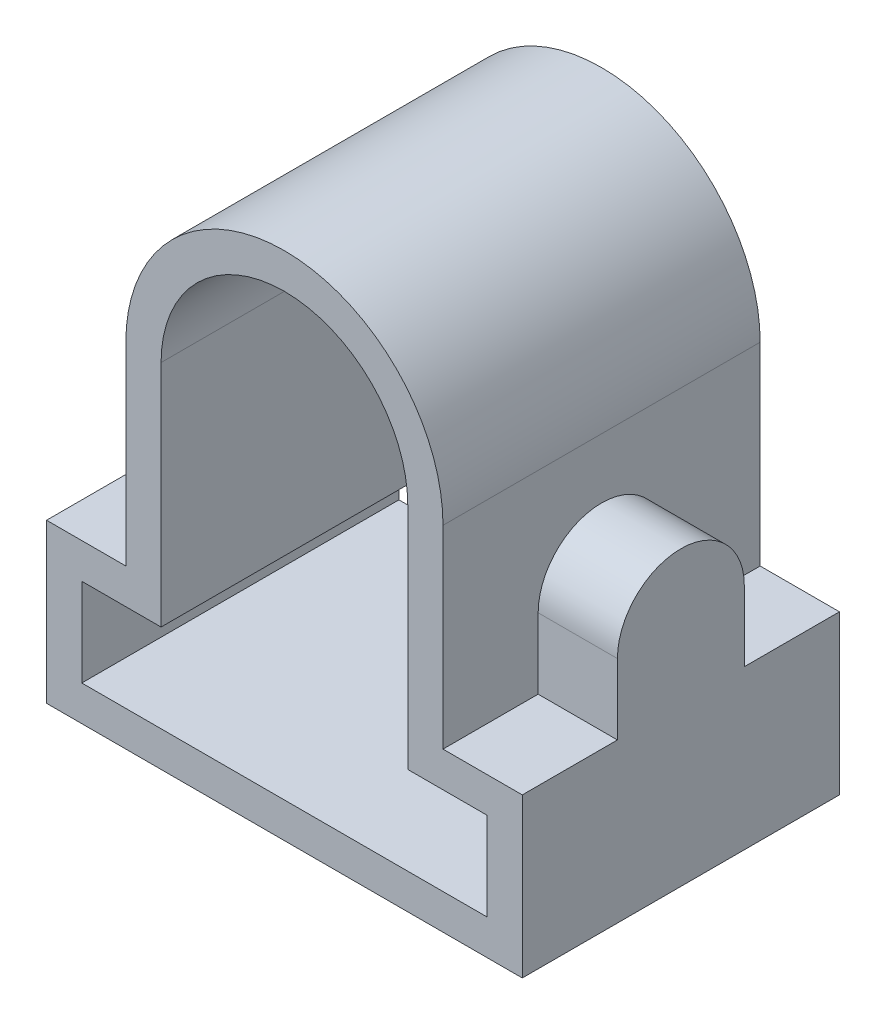
from build123d import *

# Parameters (mm, degrees)
DODANIE_WYCI_GNI_CIE1_DEPTH = 45
DODANIE_WYCI_GNI_CIE3_DEPTH = 22.5


with BuildPart() as part:
    # Szkic1 → Dodanie-wyciągnięcie1 (new, symmetric)
    with BuildSketch(Plane.XY):
        with BuildLine():
            Line((67.5, 0), (-67.5, 0))
            Line((-67.5, 0), (-67.5, 45))
            Line((-67.5, 45), (-45, 45))
            Line((-45, 45), (-45, 100))
            ThreePointArc((-45, 100), (0, 145), (45, 100))
            Line((45, 100), (45, 45))
            Line((45, 45), (67.5, 45))
            Line((67.5, 45), (67.5, 0))
        make_face()
        with BuildLine():
            Line((35, 35), (35, 100))
            ThreePointArc((35, 100), (0, 135), (-35, 100))
            Line((-35, 100), (-35, 35))
            Line((-35, 35), (-57.5, 35))
            Line((-57.5, 35), (-57.5, 10))
            Line((-57.5, 10), (57.5, 10))
            Line((57.5, 10), (57.5, 35))
            Line((57.5, 35), (35, 35))
        make_face(mode=Mode.SUBTRACT)
    extrude(amount=DODANIE_WYCI_GNI_CIE1_DEPTH, both=True)

    # Szkic2 → Dodanie-wyciągnięcie3 (add)
    with BuildSketch(Plane(origin=(67.5, 0, 0), x_dir=(0, 0, -1), z_dir=(1, 0, 0))):
        with BuildLine():
            Line((-18, 45), (18, 45))
            Line((18, 45), (18, 65))
            ThreePointArc((18, 65), (0, 83), (-18, 65))
            Line((-18, 65), (-18, 45))
        make_face()
    extrude(amount=-DODANIE_WYCI_GNI_CIE3_DEPTH)


solid = part.part
